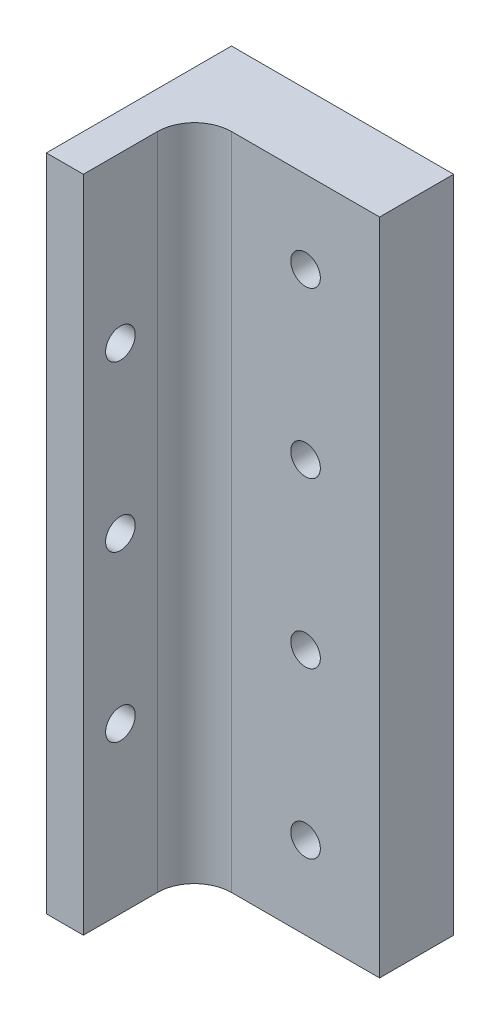
from build123d import *

# Parameters (mm, degrees)
BOSS_EXTRUDE1_DEPTH     = 10
CUT_EXTRUDE1_DEPTH      = 72.414284285
CUT_EXTRUDE1_DEPTH_BACK = 72.414284285
SKETCH2_R               = 1.5
SKETCH9_W               = 10
SKETCH9_H               = 50
BOSS_EXTRUDE9_DEPTH     = 5
SKETCH10_W              = 10
SKETCH10_H              = 50
BOSS_EXTRUDE10_DEPTH    = 5
BOSS_EXTRUDE11_DEPTH    = 2
SKETCH12_W              = 10
SKETCH12_H              = 10
BOSS_EXTRUDE12_DEPTH    = 5
CUT_EXTRUDE2_START      = 7
SKETCH13_R              = 1.5
CUT_EXTRUDE2_DEPTH      = 7
BOSS_EXTRUDE13_DEPTH    = 2
SKETCH15_W              = 9.981523119
SKETCH15_H              = 10
BOSS_EXTRUDE14_DEPTH    = 30
SKETCH16_R              = 1.5
CUT_EXTRUDE3_DEPTH      = 32
SKETCH17_W              = 10
SKETCH17_H              = 89
BOSS_EXTRUDE15_DEPTH    = 30
SKETCH19_W              = 5
SKETCH19_H              = 89
BOSS_EXTRUDE16_DEPTH    = 15
FILLET1_R               = 5
SKETCH20_R              = 2
CUT_EXTRUDE4_DEPTH      = 149.657324071
SKETCH21_R              = 2
CUT_EXTRUDE5_DEPTH      = 10
SKETCH22_W              = 110
SKETCH22_H              = 89
CUT_EXTRUDE6_DEPTH      = 104.435970532


with BuildPart() as part:
    # Sketch1 → Boss-Extrude1 (new body)
    with BuildSketch(Plane.XY):
        with BuildLine():
            Line((45.018476881, -25), (50, -25))
            Line((50, -25), (50, 25))
            Line((50, 25), (45, 25))
            ThreePointArc((45, 25), (0, 8), (-45, 25))
            Line((-45, 25), (-50, 25))
            Line((-50, 25), (-50, -25))
            Line((-50, -25), (-45.018476881, -25))
            ThreePointArc((-45.018476881, -25), (0, -8), (45.018476881, -25))
        make_face()
    extrude(amount=BOSS_EXTRUDE1_DEPTH)

    # Sketch2 → Cut-Extrude1 (cut, two sides: drawn at the far end of the back side and taken through both)
    with BuildSketch(Plane(origin=(0, 25, 0), x_dir=(1, 0, 0), z_dir=(0, 1, 0)).offset(-CUT_EXTRUDE1_DEPTH_BACK)):
        with Locations(Location((-48, -5, 0), (0, 0, 180))):
            Circle(SKETCH2_R)
        with Locations(Location((48, -5, 0), (0, 0, 180))):
            Circle(SKETCH2_R)
    extrude(amount=CUT_EXTRUDE1_DEPTH + CUT_EXTRUDE1_DEPTH_BACK, mode=Mode.SUBTRACT)

    # Sketch9 → Boss-Extrude9 (add)
    with BuildSketch(Plane(origin=(50, 0, 0), x_dir=(0, 0, -1), z_dir=(1, 0, 0))):
        with Locations((-5, 0)):
            Rectangle(SKETCH9_W, SKETCH9_H)
    extrude(amount=BOSS_EXTRUDE9_DEPTH)

    # Sketch10 → Boss-Extrude10 (add)
    with BuildSketch(Plane.ZY.offset(50)):
        with Locations((5, 0)):
            Rectangle(SKETCH10_W, SKETCH10_H)
    extrude(amount=BOSS_EXTRUDE10_DEPTH)

    # Sketch11 → Boss-Extrude11 (add)
    with BuildSketch(Plane(origin=(0, 25, 0), x_dir=(1, 0, 0), z_dir=(0, 1, 0))):
        Polygon((50, 0), (50, -7), (45, -7), (45, -10), (55, -10), (55, 0), align=None)
        Polygon((-50, 0), (-50, -7), (-45, -7), (-45, -10), (-55, -10), (-55, 0), align=None)
    extrude(amount=BOSS_EXTRUDE11_DEPTH)

    # Sketch12 → Boss-Extrude12 (add)
    with BuildSketch(Plane(origin=(0, 27, 0), x_dir=(1, 0, 0), z_dir=(0, 1, 0))):
        with Locations((50, -5)):
            Rectangle(SKETCH12_W, SKETCH12_H)
        with Locations((-50, -5)):
            Rectangle(SKETCH12_W, SKETCH12_H)
    extrude(amount=BOSS_EXTRUDE12_DEPTH)

    # Sketch13 → Cut-Extrude2 (cut)
    with BuildSketch(Plane(origin=(0, 25, 0), x_dir=(1, 0, 0), z_dir=(0, 1, 0)).offset(CUT_EXTRUDE2_START)):
        with Locations(Location((48, -5, 0), (0, 0, 180))):
            Circle(SKETCH13_R)
        with Locations(Location((-48, -5, 0), (0, 0, 180))):
            Circle(SKETCH13_R)
    extrude(amount=-CUT_EXTRUDE2_DEPTH, mode=Mode.SUBTRACT)

    # Sketch14 → Boss-Extrude13 (add)
    with BuildSketch(Plane.XZ.offset(25)):
        Polygon((50.009238441, 0), (50.009238441, 7), (45.018476881, 7), (45.018476881, 10), (55, 10), (55, 0), align=None)
        Polygon((-50.009238441, 0), (-50.009238441, 7), (-45.018476881, 7), (-45.018476881, 10), (-55, 10), (-55, 0), align=None)
    extrude(amount=BOSS_EXTRUDE13_DEPTH)

    # Sketch15 → Boss-Extrude14 (add)
    with BuildSketch(Plane.XZ.offset(27)):
        with Locations((-50.00923844, 5)):
            Rectangle(SKETCH15_W, SKETCH15_H)
        with Locations((50.00923844, 5)):
            Rectangle(SKETCH15_W, SKETCH15_H)
    extrude(amount=BOSS_EXTRUDE14_DEPTH)

    # Sketch16 → Cut-Extrude3 (cut)
    with BuildSketch(Plane.XZ.offset(25)):
        with Locations(Location((48, 5, 0), (0, 0, 180))):
            Circle(SKETCH16_R)
        with Locations(Location((-48, 5, 0), (0, 0, 180))):
            Circle(SKETCH16_R)
    extrude(amount=CUT_EXTRUDE3_DEPTH, mode=Mode.SUBTRACT)

    # Sketch17 → Boss-Extrude15 (add)
    with BuildSketch(Plane.ZY.offset(55)):
        with Locations((5, -12.5)):
            Rectangle(SKETCH17_W, SKETCH17_H)
    extrude(amount=BOSS_EXTRUDE15_DEPTH)

    # Sketch19 → Boss-Extrude16 (add)
    with BuildSketch(Plane.XY.offset(10)):
        with Locations((-82.5, -12.5)):
            Rectangle(SKETCH19_W, SKETCH19_H)
    extrude(amount=BOSS_EXTRUDE16_DEPTH)

    # Fillet1
    fillet1_edges = [part.edges().sort_by_distance(p)[0] for p in [
        (-80, -12.5, 10),
    ]]
    fillet(fillet1_edges, radius=FILLET1_R)

    # Sketch20 → Cut-Extrude4 (cut, through all)
    with BuildSketch(Plane(origin=(-80, 0, 0), x_dir=(0, 0, -1), z_dir=(1, 0, 0))):
        with Locations(Location((-20, 9.75, 0), (0, 0, 90))):
            Circle(SKETCH20_R)
        with Locations(Location((-20, -12.5, 0), (0, 0, 90))):
            Circle(SKETCH20_R)
        with Locations(Location((-20, -34.75, 0), (0, 0, 90))):
            Circle(SKETCH20_R)
    extrude(amount=-CUT_EXTRUDE4_DEPTH, mode=Mode.SUBTRACT)

    # Sketch21 → Cut-Extrude5 (cut)
    with BuildSketch(Plane.XY.offset(10)):
        with Locations((-65, 20.875)):
            Circle(SKETCH21_R)
        with Locations((-65, -1.375)):
            Circle(SKETCH21_R)
        with Locations((-65, -23.625)):
            Circle(SKETCH21_R)
        with Locations((-65, -45.875)):
            Circle(SKETCH21_R)
    extrude(amount=-CUT_EXTRUDE5_DEPTH, mode=Mode.SUBTRACT)

    # Sketch22 → Cut-Extrude6 (cut, through all)
    with BuildSketch(Plane.XY.offset(10)):
        with Locations((0, -12.5)):
            Rectangle(SKETCH22_W, SKETCH22_H)
    extrude(amount=-CUT_EXTRUDE6_DEPTH, mode=Mode.SUBTRACT)


solid = part.part
